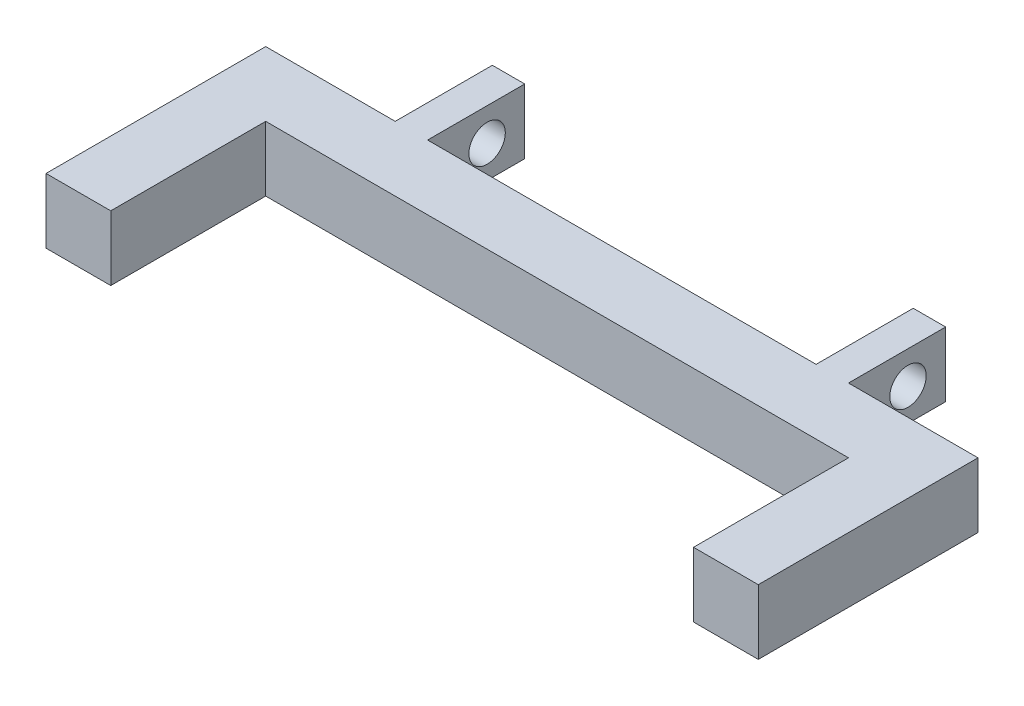
from build123d import *

# Parameters (mm, degrees)
SKETCH1_W           = 25.4
SKETCH1_H           = 76.2
BOSS_EXTRUDE1_DEPTH = 50.8
SKETCH2_R           = 14.2875
CUT_EXTRUDE1_DEPTH  = 488.833224229


with BuildPart() as part:
    # Sketch1 → Boss-Extrude1 (new body)
    with BuildSketch(Plane(origin=(0, 0, 0), x_dir=(1, 0, 0), z_dir=(0, 1, 0))):
        Polygon((-279.4, 86.184650326), (-279.4, -86.184650326), (-228.6, -86.184650326), (-228.6, 35.384650326), (228.6, 35.384650326), (228.6, -86.184650326), (279.4, -86.184650326), (279.4, 86.184650326), (177.8, 86.184650326), (152.4, 86.184650326), (-152.4, 86.184650326), (-177.8, 86.184650326), align=None)
        with Locations((-165.1, 124.284650326)):
            Rectangle(SKETCH1_W, SKETCH1_H)
        with Locations((165.1, 124.284650326)):
            Rectangle(SKETCH1_W, SKETCH1_H)
    extrude(amount=BOSS_EXTRUDE1_DEPTH)

    # Sketch2 → Cut-Extrude1 (cut, through all)
    with BuildSketch(Plane(origin=(177.8, 0, 0), x_dir=(0, 0, -1), z_dir=(1, 0, 0))):
        with Locations(Location((132.85952271, 25.273316146, 0), (0, 0, 180))):
            Circle(SKETCH2_R)
    extrude(amount=-CUT_EXTRUDE1_DEPTH, mode=Mode.SUBTRACT)


solid = part.part
